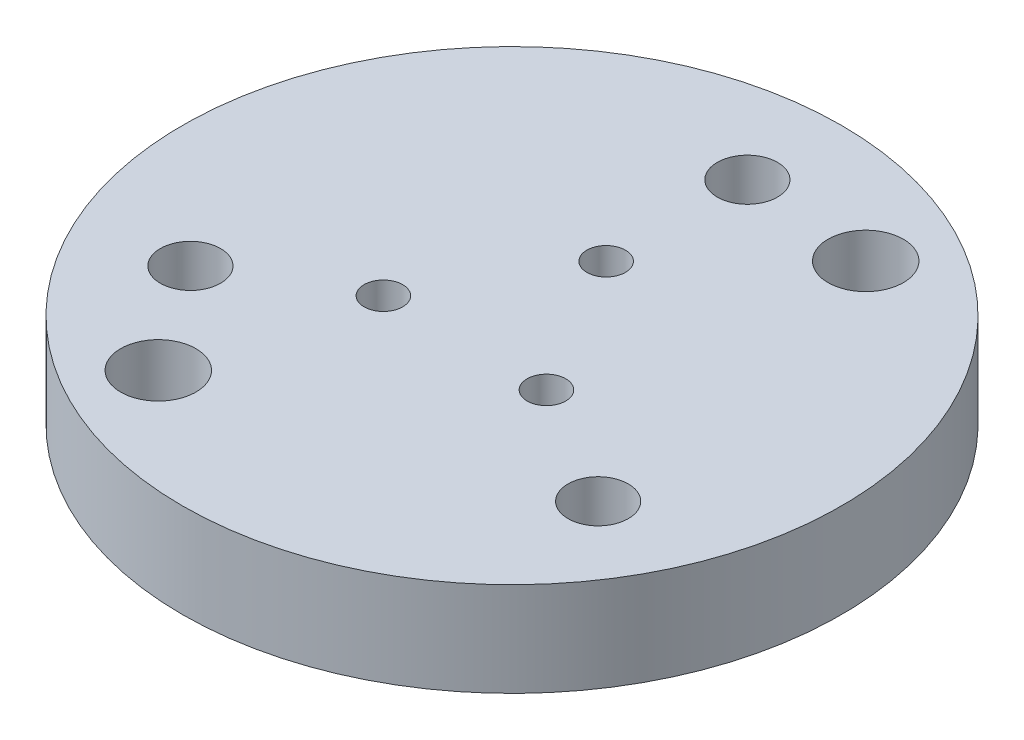
from build123d import *

# Parameters (mm, degrees)
SKETCH1_R             = 35
BOSS_EXTRUDE1_DEPTH   = 10
CUT_EXTRUDE1_REACH    = 52.498
SKETCH2_R             = 2.05
F_8_0MM_DOWEL_HOLE1_D = 8
M6_CLEARANCE_HOLE1_D  = 6.4


with BuildPart() as part:
    # Sketch1 → Boss-Extrude1 (new body)
    with BuildSketch(Plane(origin=(0, 0, 0), x_dir=(1, 0, 0), z_dir=(0, 1, 0))):
        with Locations(Location((0, 0, 0), (0, 0, 270))):
            Circle(SKETCH1_R)
    extrude(amount=-BOSS_EXTRUDE1_DEPTH)

    # Sketch2 → Cut-Extrude1 (cut, up to next)
    with BuildSketch(Plane(origin=(0, 0, 0), x_dir=(1, 0, 0), z_dir=(0, 1, 0)), mode=Mode.PRIVATE) as cut_extrude1_sk1:
        with Locations(Location((8.660254038, -5, 0), (0, 0, 270))):
            Circle(SKETCH2_R)
    cut_extrude1_tool1 = extrude(cut_extrude1_sk1.sketch, amount=-CUT_EXTRUDE1_REACH, mode=Mode.PRIVATE) & part.part
    # Sketch2 → Cut-Extrude1 (cut, up to next)
    with BuildSketch(Plane(origin=(0, 0, 0), x_dir=(1, 0, 0), z_dir=(0, 1, 0)), mode=Mode.PRIVATE) as cut_extrude1_sk2:
        with Locations(Location((0, 10, 0), (0, 0, 270))):
            Circle(SKETCH2_R)
    cut_extrude1_tool2 = extrude(cut_extrude1_sk2.sketch, amount=-CUT_EXTRUDE1_REACH, mode=Mode.PRIVATE) & part.part
    # Sketch2 → Cut-Extrude1 (cut, up to next)
    with BuildSketch(Plane(origin=(0, 0, 0), x_dir=(1, 0, 0), z_dir=(0, 1, 0)), mode=Mode.PRIVATE) as cut_extrude1_sk3:
        with Locations(Location((-8.660254038, -5, 0), (0, 0, 270))):
            Circle(SKETCH2_R)
    cut_extrude1_tool3 = extrude(cut_extrude1_sk3.sketch, amount=-CUT_EXTRUDE1_REACH, mode=Mode.PRIVATE) & part.part
    add(cut_extrude1_tool1.solids().sort_by_distance((8.660254, 0, 5))[0], mode=Mode.SUBTRACT)
    add(cut_extrude1_tool2.solids().sort_by_distance((0, 0, -10))[0], mode=Mode.SUBTRACT)
    add(cut_extrude1_tool3.solids().sort_by_distance((-8.660254, 0, 5))[0], mode=Mode.SUBTRACT)

    # Ø8.0mm Dowel Hole1 (through all)
    with Locations(Plane(origin=(0, -10, 0), x_dir=(-1, 0, 0), z_dir=(0, -1, 0))):
        with Locations((-13.75, 23.815698604), (13.75, -23.815698604)):
            Hole(F_8_0MM_DOWEL_HOLE1_D / 2)

    # M6 Clearance Hole1 (through all)
    with Locations(Plane(origin=(0, -10, 0), x_dir=(-1, 0, 0), z_dir=(0, -1, 0))):
        with Locations((-21.650635095, -12.5), (21.650635095, -12.5), (0, 25)):
            Hole(M6_CLEARANCE_HOLE1_D / 2)


solid = part.part
